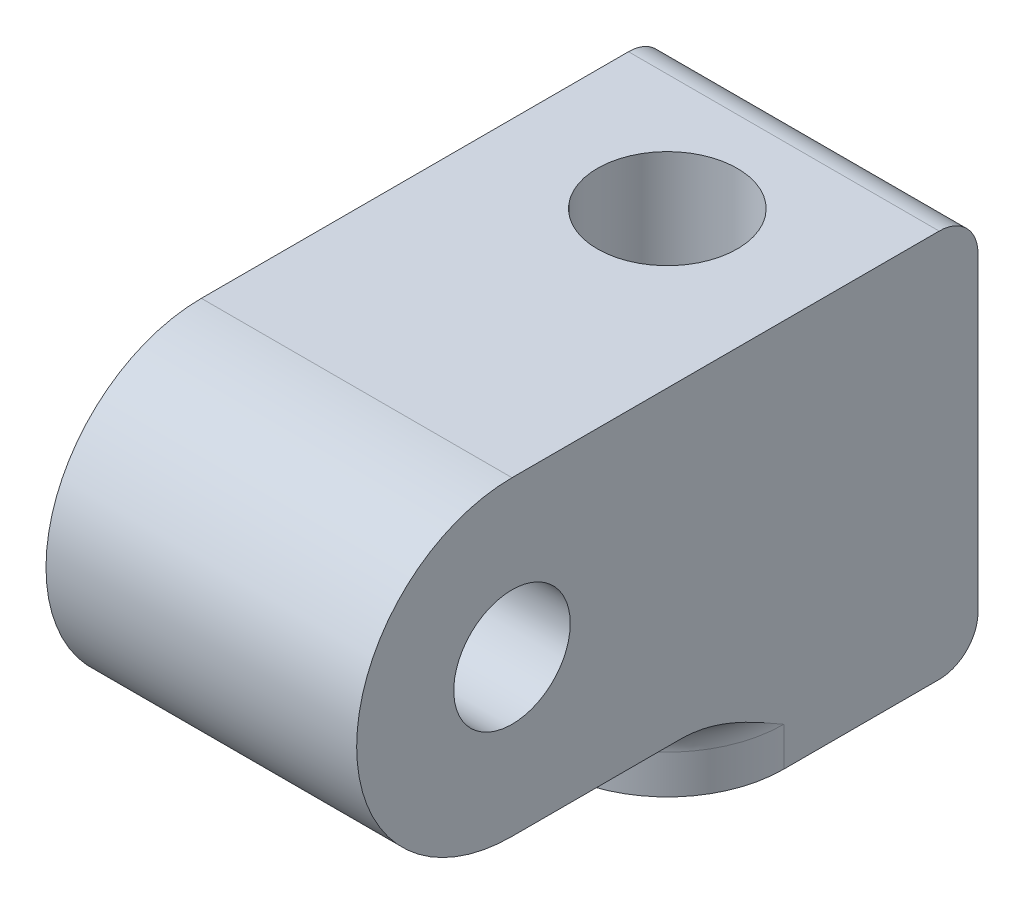
from build123d import *

# Parameters (mm, degrees)
SKETCH1_R           = 1.905
BOSS_EXTRUDE1_DEPTH = 10.16
SKETCH2_R           = 2.286
CUT_EXTRUDE1_DEPTH  = 20.176579466
FILLET2_R           = 3.81
FILLET1_R           = 1.27


with BuildPart() as part:
    # Sketch1 → Boss-Extrude1 (new body)
    with BuildSketch(Plane(origin=(0, 0, 0), x_dir=(0, 0, -1), z_dir=(1, 0, 0))):
        with BuildLine():
            Line((0, 0), (10.16, 0))
            Line((10.16, 0), (10.16, 12.7))
            Line((10.16, 12.7), (-5.08, 12.7))
            ThreePointArc((-5.08, 12.7), (-10.16, 7.62), (-5.08, 2.54))
            Line((-5.08, 2.54), (0, 2.54))
            Line((0, 2.54), (0, 0))
        make_face()
        with Locations((-5.08, 7.62)):
            Circle(SKETCH1_R, mode=Mode.SUBTRACT)
    extrude(amount=BOSS_EXTRUDE1_DEPTH)

    # Sketch2 → Cut-Extrude1 (cut, through all)
    with BuildSketch(Plane(origin=(0, 12.7, 0), x_dir=(1, 0, 0), z_dir=(0, 1, 0))):
        with Locations(Location((5.08, 5.08, 0), (0, 0, 270))):
            Circle(SKETCH2_R)
    extrude(amount=-CUT_EXTRUDE1_DEPTH, mode=Mode.SUBTRACT)

    # Fillet2
    fillet2_edges = [part.edges().sort_by_distance(p)[0] for p in [
        (10.16, 1.27, 0),
        (0, 1.27, 0),
    ]]
    fillet(fillet2_edges, radius=FILLET2_R)

    # Fillet1
    fillet1_edges = [part.edges().sort_by_distance(p)[0] for p in [
        (5.08, 2.54, 0),
        (1.115923164, 2.54, -1.115923164),
        (9.044076836, 2.54, -1.115923164),
        (5.08, 0, -10.16),
        (5.08, 12.7, -10.16),
    ]]
    fillet(fillet1_edges, radius=FILLET1_R)


solid = part.part
